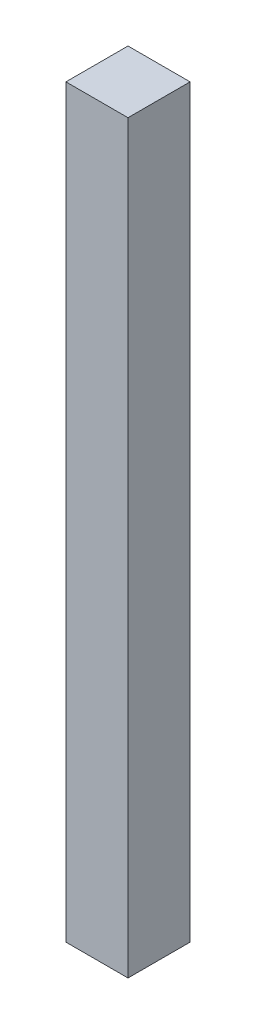
from build123d import *

# Parameters (mm, degrees)
SKETCH1_W           = 25.4
SKETCH1_H           = 25.4
BOSS_EXTRUDE1_DEPTH = 304.8


with BuildPart() as part:
    # Sketch1 → Boss-Extrude1 (new body)
    with BuildSketch(Plane(origin=(0, 0, 0), x_dir=(1, 0, 0), z_dir=(0, 1, 0))):
        with Locations((-1.9706829, -7.760423265)):
            Rectangle(SKETCH1_W, SKETCH1_H)
    extrude(amount=BOSS_EXTRUDE1_DEPTH)


solid = part.part
